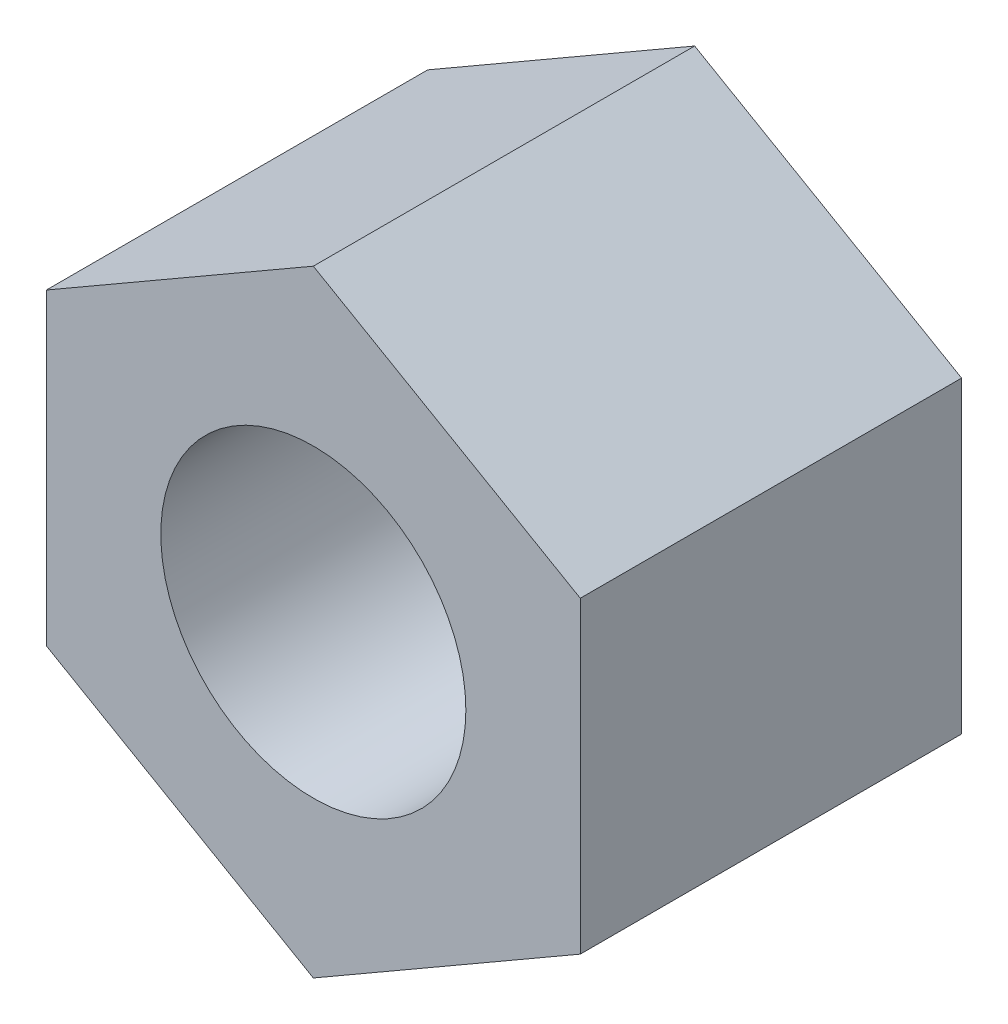
from build123d import *

# Parameters (mm, degrees)
HEXAGONO_DEPTH = 5
CROQUIS2_R     = 2
ROSCA_DEPTH    = 5


with BuildPart() as part:
    # Croquis1 → Hexagono (new body)
    with BuildSketch(Plane.XY):
        Polygon((3.5, 2.020725942), (0, 4.041451884), (-3.5, 2.020725942), (-3.5, -2.020725942), (0, -4.041451884), (3.5, -2.020725942), align=None)
    extrude(amount=HEXAGONO_DEPTH)

    # Croquis2 → Rosca (cut)
    with BuildSketch(Plane.XY):
        Circle(CROQUIS2_R)
    extrude(amount=ROSCA_DEPTH, mode=Mode.SUBTRACT)


solid = part.part
